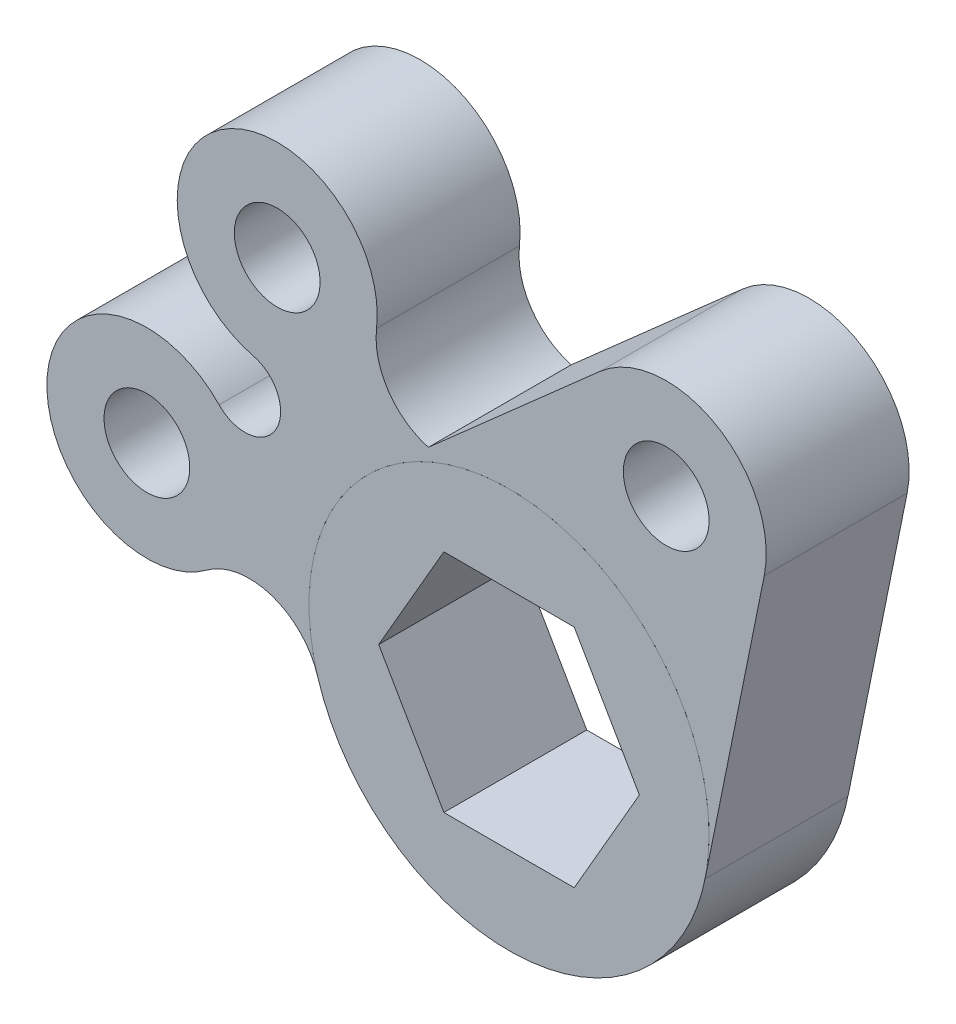
from build123d import *

# Parameters (mm, degrees)
SKETCH_1_R      = 7
EXTRUDE_1_DEPTH = 5
SKETCH_2_R      = 1.5
EXTRUDE_4_DEPTH = 5


with BuildPart() as part:
    # Эскиз1 → Бобышка-Вытянуть1 (new body)
    with BuildSketch(Plane.XY):
        Circle(SKETCH_1_R)
        Polygon((2.280533563, -3.95), (4.561067127, 0), (2.280533563, 3.95), (-2.280533563, 3.95), (-4.561067127, 0), (-2.280533563, -3.95), align=None, mode=Mode.SUBTRACT)
    extrude(amount=EXTRUDE_1_DEPTH)


with BuildPart() as body_2:
    # Эскиз2 → Бобышка-Вытянуть4 (new body)
    with BuildSketch(Plane(origin=(0, 0, 0), x_dir=(-1, 0, 0), z_dir=(0, 0, -1))):
        with BuildLine():
            ThreePointArc((-3.183255839, 12.149768815), (-7.25, 12.557368355), (-8.930380524, 8.831664831))
            Line((-8.930380524, 8.831664831), (-6.860761049, -1.389229221))
            ThreePointArc((-6.860761049, -1.389229221), (0.333277598, 6.992061645), (6.697521487, -2.035486659))
            ThreePointArc((6.697521487, -2.035486659), (8.308163671, -0.387678075), (10.582553783, -0.757260263))
            ThreePointArc((10.582553783, -0.757260263), (16.160709129, 2.341131993), (10.146078615, 4.471876327))
            ThreePointArc((10.146078615, 4.471876327), (8.161132603, 4.711832074), (8.945797756, 6.550823653))
            ThreePointArc((8.945797756, 6.550823653), (10.107834404, 12.825018611), (4.635470256, 9.543390634))
            ThreePointArc((4.635470256, 9.543390634), (4.228105436, 7.859600013), (2.824036783, 6.844864498))
            Line((2.824036783, 6.844864498), (-3.183255839, 12.149768815))
        make_face()
        with Locations((-5.5, 9.526279442)):
            Circle(SKETCH_2_R, mode=Mode.SUBTRACT)
        with Locations((12.672838409, 2.05)):
            Circle(SKETCH_2_R, mode=Mode.SUBTRACT)
        with Locations((8.111771282, 9.95)):
            Circle(SKETCH_2_R, mode=Mode.SUBTRACT)
    extrude(amount=-EXTRUDE_4_DEPTH)


solid = Compound([part.part, body_2.part])
